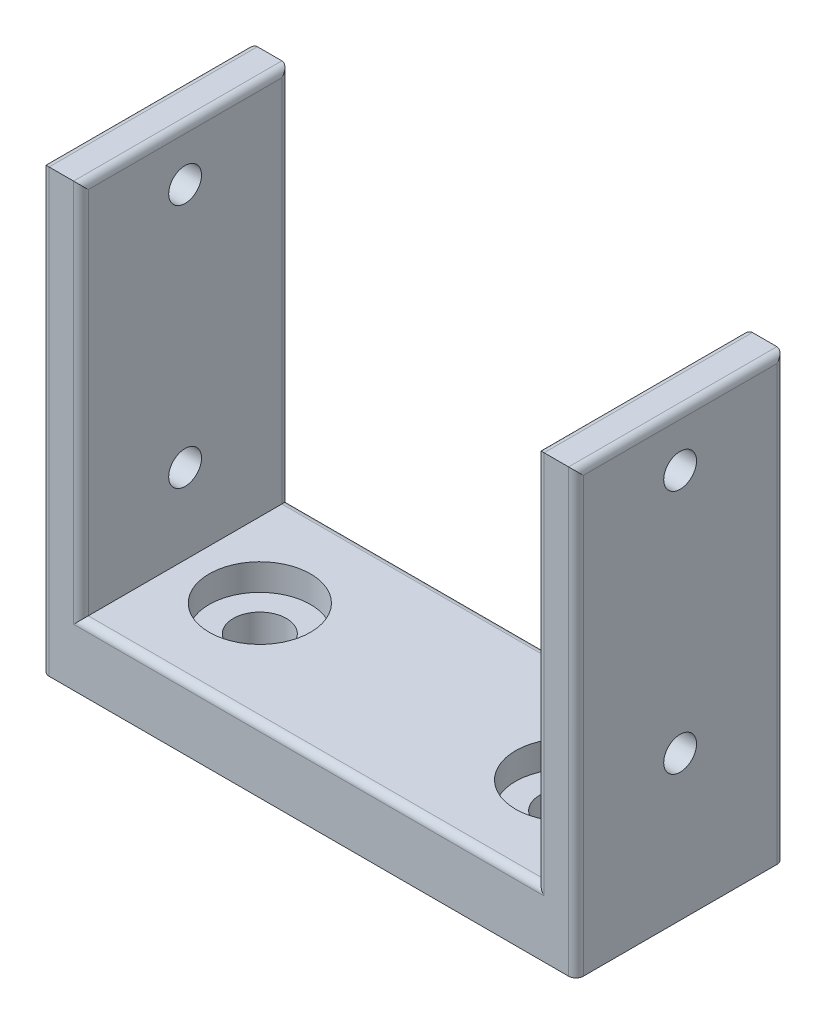
from build123d import *

# Parameters (mm, degrees)
SKETCH1_W                       = 55.372
SKETCH1_H                       = 21.59
BOSS_EXTRUDE1_DEPTH             = 4.1599866
SKETCH2_W                       = 4.064
SKETCH2_H                       = 21.59
BOSS_EXTRUDE2_DEPTH             = 39.0200134
M3_CLEARANCE_HOLE2_D            = 3.4
SKETCH1_2_W                     = 55.372
SKETCH1_2_H                     = 21.59
BOSS_EXTRUDE3_DEPTH             = 2.54
CBORE_FOR_M5_SBHCS1_D           = 5.5
CBORE_FOR_M5_SBHCS1_CBORE_D     = 10.5
CBORE_FOR_M5_SBHCS1_CBORE_DEPTH = 2.75
FILLET1_R                       = 0.762


with BuildPart() as part:
    # Sketch1 → Boss-Extrude1 (new body)
    with BuildSketch(Plane(origin=(0, 0, 0), x_dir=(1, 0, 0), z_dir=(0, 1, 0))):
        with Locations((27.686, 10.795)):
            Rectangle(SKETCH1_W, SKETCH1_H)
    extrude(amount=BOSS_EXTRUDE1_DEPTH)

    # Sketch2 → Boss-Extrude2 (add)
    with BuildSketch(Plane(origin=(0, 4.1599866, 0), x_dir=(1, 0, 0), z_dir=(0, 1, 0))):
        with Locations((2.032, 10.795)):
            Rectangle(SKETCH2_W, SKETCH2_H)
        with Locations((53.34, 10.795)):
            Rectangle(SKETCH2_W, SKETCH2_H)
    extrude(amount=BOSS_EXTRUDE2_DEPTH)

    # M3 Clearance Hole2 (through all)
    with Locations(Plane.ZY):
        with Locations((-10.795, 37.8599954), (-10.795, 12.4599954)):
            Hole(M3_CLEARANCE_HOLE2_D / 2)

    # Sketch1<2> → Boss-Extrude3 (add)
    with BuildSketch(Plane(origin=(0, 0, 0), x_dir=(1, 0, 0), z_dir=(0, 1, 0))):
        with Locations((27.686, 10.795)):
            Rectangle(SKETCH1_2_W, SKETCH1_2_H)
    extrude(amount=-BOSS_EXTRUDE3_DEPTH)

    # CBORE for M5 SBHCS1 (through all)
    with Locations(Plane(origin=(0, 4.1599866, 0), x_dir=(1, 0, 0), z_dir=(0, 1, 0))):
        with Locations((11.811, 10.795), (43.561, 10.795)):
            CounterBoreHole(CBORE_FOR_M5_SBHCS1_D / 2, CBORE_FOR_M5_SBHCS1_CBORE_D / 2, CBORE_FOR_M5_SBHCS1_CBORE_DEPTH)

    # Fillet1
    fillet1_edges = [part.edges().sort_by_distance(p)[0] for p in [
        (4.064, 23.6699933, -21.59),
        (27.686, 4.1599866, -21.59),
        (51.308, 23.6699933, -21.59),
        (55.372, 20.32, -21.59),
        (51.308, 43.18, -10.795),
        (55.372, 43.18, -10.795),
        (27.686, 4.1599866, 0),
        (51.308, 23.6699933, 0),
        (55.372, 20.32, 0),
        (4.064, 43.18, -10.795),
        (0, 43.18, -10.795),
        (0, 20.32, -21.59),
        (0, 20.32, 0),
        (4.064, 23.6699933, 0),
    ]]
    fillet(fillet1_edges, radius=FILLET1_R)


solid = part.part
